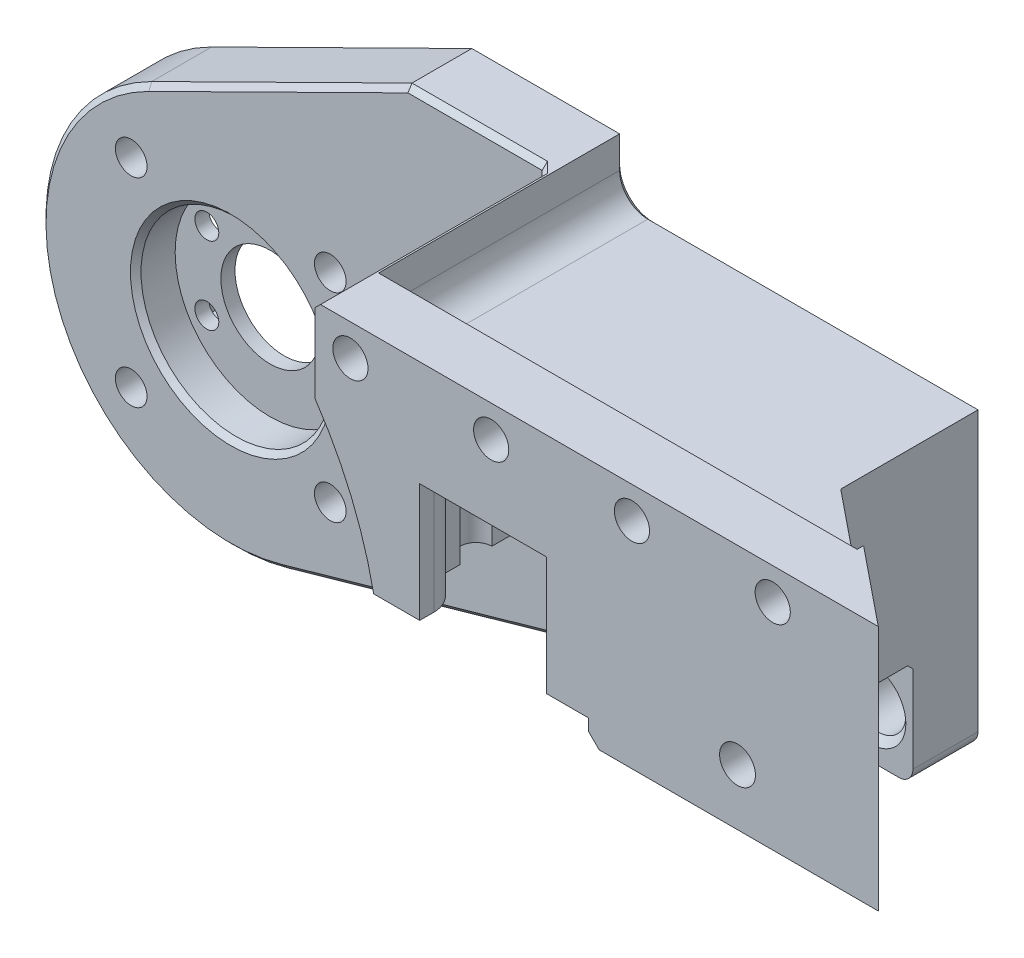
from build123d import *

# Parameters (mm, degrees)
SKETCH1_W           = 270
SKETCH1_H           = 35
BOSS_EXTRUDE1_DEPTH = 10
SKETCH2_W           = 270
SKETCH2_H           = 26
BOSS_EXTRUDE2_DEPTH = 1
CUT_EXTRUDE1_REACH  = 141.821
SKETCH3_R           = 2.55
CUT_EXTRUDE3_REACH  = 141.896
SKETCH4_R           = 8
SKETCH5_R           = 10
CUT_EXTRUDE4_DEPTH  = 1.5
CUT_EXTRUDE5_START  = -1.5
SKETCH6_R           = 10
CUT_EXTRUDE5_DEPTH  = 1.5
BOSS_EXTRUDE3_DEPTH = 43
CUT_EXTRUDE7_DEPTH  = 11
CUT_EXTRUDE8_DEPTH  = 33
SKETCH11_R          = 13.5
SKETCH11_R_2        = 2.25
CUT_EXTRUDE9_DEPTH  = 223.744809143
CUT_EXTRUDE10_REACH = 224.549
SKETCH13_W          = 24
SKETCH13_H          = 30
CUT_EXTRUDE11_DEPTH = 2.4
BOSS_EXTRUDE4_START = -2
SKETCH14_R          = 7
BOSS_EXTRUDE4_DEPTH = 2
CUT_EXTRUDE12_REACH = 226.37
SKETCH16_R          = 1.7
SKETCH17_W          = 24
SKETCH17_H          = 5
CUT_EXTRUDE13_DEPTH = 2
CHAMFER1_SIZE       = 1
CUT_EXTRUDE15_REACH = 224.549
SKETCH20_R          = 2.5
SKETCH18_W          = 295.252066252
SKETCH18_H          = 62.982253344
CUT_EXTRUDE14_DEPTH = 11
CUT_EXTRUDE16_REACH = 232.549
CUT_EXTRUDE16_START = -8
SKETCH26_W          = 25
SKETCH26_H          = 41.606355273
BOSS_EXTRUDE6_DEPTH = 10
SKETCH27_R          = 4
CUT_EXTRUDE19_DEPTH = 8
FILLET1_R           = 2
CUT_EXTRUDE20_DEPTH = 20
SKETCH29_W          = 33.834298197
SKETCH29_H          = 26.449884055
CUT_EXTRUDE21_DEPTH = 3.175
SKETCH30_R          = 1.9
CUT_EXTRUDE22_DEPTH = 15
SKETCH31_R          = 2.25
CUT_EXTRUDE23_DEPTH = 16.825
CUT_EXTRUDE24_REACH = 224.549
SKETCH32_R          = 2.55
BOSS_EXTRUDE7_REACH = 224.549
SKETCH34_W          = 12.654945339
SKETCH34_H          = 26.5
CHAMFER2_SIZE       = 2.25
CHAMFER3_SIZE       = 1
CHAMFER4_SIZE       = 0.75
CHAMFER6_SIZE       = 1.5


with BuildPart() as part:
    # Sketch1 → Boss-Extrude1 (new body)
    with BuildSketch(Plane.XY):
        with Locations((0, -17.5)):
            Rectangle(SKETCH1_W, SKETCH1_H)
    extrude(amount=BOSS_EXTRUDE1_DEPTH)

    # Sketch2 → Boss-Extrude2 (add)
    with BuildSketch(Plane.XY.offset(10)):
        with Locations((0, -22)):
            Rectangle(SKETCH2_W, SKETCH2_H)
    extrude(amount=BOSS_EXTRUDE2_DEPTH)

    # Sketch3 → Cut-Extrude1 (cut, up to next)
    with BuildSketch(Plane.XY.offset(10), mode=Mode.PRIVATE) as cut_extrude1_sk1:
        with Locations((-130, -4.5)):
            Circle(SKETCH3_R)
    cut_extrude1_tool1 = extrude(cut_extrude1_sk1.sketch, amount=-CUT_EXTRUDE1_REACH, mode=Mode.PRIVATE) & part.part
    # Sketch3 → Cut-Extrude1 (cut, up to next)
    with BuildSketch(Plane.XY.offset(10), mode=Mode.PRIVATE) as cut_extrude1_sk2:
        with Locations((-110, -4.5)):
            Circle(SKETCH3_R)
    cut_extrude1_tool2 = extrude(cut_extrude1_sk2.sketch, amount=-CUT_EXTRUDE1_REACH, mode=Mode.PRIVATE) & part.part
    # Sketch3 → Cut-Extrude1 (cut, up to next)
    with BuildSketch(Plane.XY.offset(10), mode=Mode.PRIVATE) as cut_extrude1_sk3:
        with Locations((-90, -4.5)):
            Circle(SKETCH3_R)
    cut_extrude1_tool3 = extrude(cut_extrude1_sk3.sketch, amount=-CUT_EXTRUDE1_REACH, mode=Mode.PRIVATE) & part.part
    # Sketch3 → Cut-Extrude1 (cut, up to next)
    with BuildSketch(Plane.XY.offset(10), mode=Mode.PRIVATE) as cut_extrude1_sk4:
        with Locations((-70, -4.5)):
            Circle(SKETCH3_R)
    cut_extrude1_tool4 = extrude(cut_extrude1_sk4.sketch, amount=-CUT_EXTRUDE1_REACH, mode=Mode.PRIVATE) & part.part
    # Sketch3 → Cut-Extrude1 (cut, up to next)
    with BuildSketch(Plane.XY.offset(10), mode=Mode.PRIVATE) as cut_extrude1_sk5:
        with Locations((-50, -4.5)):
            Circle(SKETCH3_R)
    cut_extrude1_tool5 = extrude(cut_extrude1_sk5.sketch, amount=-CUT_EXTRUDE1_REACH, mode=Mode.PRIVATE) & part.part
    # Sketch3 → Cut-Extrude1 (cut, up to next)
    with BuildSketch(Plane.XY.offset(10), mode=Mode.PRIVATE) as cut_extrude1_sk6:
        with Locations((-30, -4.5)):
            Circle(SKETCH3_R)
    cut_extrude1_tool6 = extrude(cut_extrude1_sk6.sketch, amount=-CUT_EXTRUDE1_REACH, mode=Mode.PRIVATE) & part.part
    # Sketch3 → Cut-Extrude1 (cut, up to next)
    with BuildSketch(Plane.XY.offset(10), mode=Mode.PRIVATE) as cut_extrude1_sk7:
        with Locations((-10, -4.5)):
            Circle(SKETCH3_R)
    cut_extrude1_tool7 = extrude(cut_extrude1_sk7.sketch, amount=-CUT_EXTRUDE1_REACH, mode=Mode.PRIVATE) & part.part
    # Sketch3 → Cut-Extrude1 (cut, up to next)
    with BuildSketch(Plane.XY.offset(10), mode=Mode.PRIVATE) as cut_extrude1_sk8:
        with Locations((10, -4.5)):
            Circle(SKETCH3_R)
    cut_extrude1_tool8 = extrude(cut_extrude1_sk8.sketch, amount=-CUT_EXTRUDE1_REACH, mode=Mode.PRIVATE) & part.part
    # Sketch3 → Cut-Extrude1 (cut, up to next)
    with BuildSketch(Plane.XY.offset(10), mode=Mode.PRIVATE) as cut_extrude1_sk9:
        with Locations((30, -4.5)):
            Circle(SKETCH3_R)
    cut_extrude1_tool9 = extrude(cut_extrude1_sk9.sketch, amount=-CUT_EXTRUDE1_REACH, mode=Mode.PRIVATE) & part.part
    # Sketch3 → Cut-Extrude1 (cut, up to next)
    with BuildSketch(Plane.XY.offset(10), mode=Mode.PRIVATE) as cut_extrude1_sk10:
        with Locations((50, -4.5)):
            Circle(SKETCH3_R)
    cut_extrude1_tool10 = extrude(cut_extrude1_sk10.sketch, amount=-CUT_EXTRUDE1_REACH, mode=Mode.PRIVATE) & part.part
    # Sketch3 → Cut-Extrude1 (cut, up to next)
    with BuildSketch(Plane.XY.offset(10), mode=Mode.PRIVATE) as cut_extrude1_sk11:
        with Locations((70, -4.5)):
            Circle(SKETCH3_R)
    cut_extrude1_tool11 = extrude(cut_extrude1_sk11.sketch, amount=-CUT_EXTRUDE1_REACH, mode=Mode.PRIVATE) & part.part
    # Sketch3 → Cut-Extrude1 (cut, up to next)
    with BuildSketch(Plane.XY.offset(10), mode=Mode.PRIVATE) as cut_extrude1_sk12:
        with Locations((90, -4.5)):
            Circle(SKETCH3_R)
    cut_extrude1_tool12 = extrude(cut_extrude1_sk12.sketch, amount=-CUT_EXTRUDE1_REACH, mode=Mode.PRIVATE) & part.part
    add(cut_extrude1_tool1.solids().sort_by_distance((-130, -4.5, 10))[0], mode=Mode.SUBTRACT)
    add(cut_extrude1_tool2.solids().sort_by_distance((-110, -4.5, 10))[0], mode=Mode.SUBTRACT)
    add(cut_extrude1_tool3.solids().sort_by_distance((-90, -4.5, 10))[0], mode=Mode.SUBTRACT)
    add(cut_extrude1_tool4.solids().sort_by_distance((-70, -4.5, 10))[0], mode=Mode.SUBTRACT)
    add(cut_extrude1_tool5.solids().sort_by_distance((-50, -4.5, 10))[0], mode=Mode.SUBTRACT)
    add(cut_extrude1_tool6.solids().sort_by_distance((-30, -4.5, 10))[0], mode=Mode.SUBTRACT)
    add(cut_extrude1_tool7.solids().sort_by_distance((-10, -4.5, 10))[0], mode=Mode.SUBTRACT)
    add(cut_extrude1_tool8.solids().sort_by_distance((10, -4.5, 10))[0], mode=Mode.SUBTRACT)
    add(cut_extrude1_tool9.solids().sort_by_distance((30, -4.5, 10))[0], mode=Mode.SUBTRACT)
    add(cut_extrude1_tool10.solids().sort_by_distance((50, -4.5, 10))[0], mode=Mode.SUBTRACT)
    add(cut_extrude1_tool11.solids().sort_by_distance((70, -4.5, 10))[0], mode=Mode.SUBTRACT)
    add(cut_extrude1_tool12.solids().sort_by_distance((90, -4.5, 10))[0], mode=Mode.SUBTRACT)

    # Sketch4 → Cut-Extrude3 (cut, up to next)
    with BuildSketch(Plane.XY.offset(11), mode=Mode.PRIVATE) as cut_extrude3_sk1:
        with Locations((123, -20.5)):
            Circle(SKETCH4_R)
    cut_extrude3_tool1 = extrude(cut_extrude3_sk1.sketch, amount=-CUT_EXTRUDE3_REACH, mode=Mode.PRIVATE) & part.part
    add(cut_extrude3_tool1.solids().sort_by_distance((123, -20.5, 11))[0], mode=Mode.SUBTRACT)

    # Sketch5 → Cut-Extrude4 (cut)
    with BuildSketch(Plane.XY.offset(11)):
        with Locations((123, -20.5)):
            Circle(SKETCH5_R)
    extrude(amount=-CUT_EXTRUDE4_DEPTH, mode=Mode.SUBTRACT)

    # Sketch6 → Cut-Extrude5 (cut)
    with BuildSketch(Plane(origin=(0, 0, 0), x_dir=(-1, 0, 0), z_dir=(0, 0, -1)).offset(CUT_EXTRUDE5_START)):
        with Locations(Location((-123, -20.5, 0), (0, 0, 180))):
            Circle(SKETCH6_R)
    extrude(amount=CUT_EXTRUDE5_DEPTH, mode=Mode.SUBTRACT)

    # Sketch8 → Boss-Extrude3 (add)
    with BuildSketch(Plane(origin=(0, 0, 0), x_dir=(-1, 0, 0), z_dir=(0, 0, -1))):
        with BuildLine():
            Line((135, 0), (155, 0))
            Line((155, 0), (191.976940477, -18.30179972))
            ThreePointArc((191.976940477, -18.30179972), (205.188195696, -52.223929122), (172.609863555, -68.468940743))
            Line((172.609863555, -68.468940743), (55, -35))
            Line((55, -35), (55, 0))
            Line((55, 0), (135, 0))
        make_face()
    extrude(amount=BOSS_EXTRUDE3_DEPTH)

    # Sketch9 → Cut-Extrude7 (cut)
    with BuildSketch(Plane.XY.offset(11)):
        with BuildLine():
            Line((-135, -12), (-135, -35))
            Line((-135, -35), (-126.157637496, -35))
            ThreePointArc((-126.157637496, -35), (-129.258467146, -22.992390109), (-135, -12))
        make_face()
    extrude(amount=-CUT_EXTRUDE7_DEPTH, mode=Mode.SUBTRACT)

    # Sketch10 → Cut-Extrude8 (cut)
    with BuildSketch(Plane.XY):
        with BuildLine():
            Line((-135, 0), (-155, 0))
            Line((-155, 0), (-191.976940477, -18.30179972))
            ThreePointArc((-191.976940477, -18.30179972), (-205.188195696, -52.223929122), (-172.609863555, -68.468940743))
            Line((-172.609863555, -68.468940743), (-55, -35))
            Line((-55, -35), (-126.157637496, -35))
            ThreePointArc((-126.157637496, -35), (-129.258467146, -22.992390109), (-135, -12))
            Line((-135, -12), (-135, 0))
        make_face()
    extrude(amount=-CUT_EXTRUDE8_DEPTH, mode=Mode.SUBTRACT)

    # Sketch11 → Cut-Extrude9 (cut, through all)
    with BuildSketch(Plane.XY.offset(-33)):
        with Locations((-180, -42.5)):
            Circle(SKETCH11_R)
        with Locations((-165.857864376, -56.642135624)):
            Circle(SKETCH11_R_2)
        with Locations((-194.142135624, -56.642135624)):
            Circle(SKETCH11_R_2)
        with Locations((-194.142135624, -28.357864376)):
            Circle(SKETCH11_R_2)
        with Locations((-165.857864376, -28.357864376)):
            Circle(SKETCH11_R_2)
    extrude(amount=-CUT_EXTRUDE9_DEPTH, mode=Mode.SUBTRACT)

    # Sketch12 → Cut-Extrude10 (cut, up to next)
    with BuildSketch(Plane(origin=(0, 0, 0), x_dir=(1, 0, 0), z_dir=(0, 1, 0)), mode=Mode.PRIVATE) as cut_extrude10_sk1:
        Polygon((-108.083735041, 43), (-55, 0), (-55, 43), align=None)
    cut_extrude10_tool1 = extrude(cut_extrude10_sk1.sketch, amount=-CUT_EXTRUDE10_REACH, mode=Mode.PRIVATE) & part.part
    add(cut_extrude10_tool1.solids().sort_by_distance((-72.694578, 0, -28.666667))[0], mode=Mode.SUBTRACT)

    # Sketch13 → Cut-Extrude11 (cut)
    with BuildSketch(Plane(origin=(0, 0, -43), x_dir=(-1, 0, 0), z_dir=(0, 0, -1))):
        with Locations((180, -36)):
            Rectangle(SKETCH13_W, SKETCH13_H)
    extrude(amount=-CUT_EXTRUDE11_DEPTH, mode=Mode.SUBTRACT)

    # Sketch14 → Boss-Extrude4 (add)
    with BuildSketch(Plane(origin=(0, 0, -40.6), x_dir=(-1, 0, 0), z_dir=(0, 0, -1)).offset(BOSS_EXTRUDE4_START)):
        with BuildLine():
            ThreePointArc((192, -36.315341562), (180, -29), (168, -36.315341562))
            ThreePointArc((168, -36.315341562), (166.5, -42.5), (168, -48.684658438))
            ThreePointArc((168, -48.684658438), (168.696516797, -49.881142694), (169.511911518, -51))
            ThreePointArc((169.511911518, -51), (180, -56), (190.488088482, -51))
            ThreePointArc((190.488088482, -51), (191.303483203, -49.881142694), (192, -48.684658438))
            ThreePointArc((192, -48.684658438), (193.5, -42.5), (192, -36.315341562))
        make_face()
        with Locations((180, -42.5)):
            Circle(SKETCH14_R, mode=Mode.SUBTRACT)
    extrude(amount=BOSS_EXTRUDE4_DEPTH)

    # Sketch16 → Cut-Extrude12 (cut, up to next)
    with BuildSketch(Plane(origin=(0, 0, -40.6), x_dir=(-1, 0, 0), z_dir=(0, 0, -1)), mode=Mode.PRIVATE) as cut_extrude12_sk1:
        with Locations((171, -37)):
            Circle(SKETCH16_R)
    cut_extrude12_tool1 = extrude(cut_extrude12_sk1.sketch, amount=-CUT_EXTRUDE12_REACH, mode=Mode.PRIVATE) & part.part
    # Sketch16 → Cut-Extrude12 (cut, up to next)
    with BuildSketch(Plane(origin=(0, 0, -40.6), x_dir=(-1, 0, 0), z_dir=(0, 0, -1)), mode=Mode.PRIVATE) as cut_extrude12_sk2:
        with Locations((189, -37)):
            Circle(SKETCH16_R)
    cut_extrude12_tool2 = extrude(cut_extrude12_sk2.sketch, amount=-CUT_EXTRUDE12_REACH, mode=Mode.PRIVATE) & part.part
    # Sketch16 → Cut-Extrude12 (cut, up to next)
    with BuildSketch(Plane(origin=(0, 0, -40.6), x_dir=(-1, 0, 0), z_dir=(0, 0, -1)), mode=Mode.PRIVATE) as cut_extrude12_sk3:
        with Locations((189, -48)):
            Circle(SKETCH16_R)
    cut_extrude12_tool3 = extrude(cut_extrude12_sk3.sketch, amount=-CUT_EXTRUDE12_REACH, mode=Mode.PRIVATE) & part.part
    # Sketch16 → Cut-Extrude12 (cut, up to next)
    with BuildSketch(Plane(origin=(0, 0, -40.6), x_dir=(-1, 0, 0), z_dir=(0, 0, -1)), mode=Mode.PRIVATE) as cut_extrude12_sk4:
        with Locations((171, -48)):
            Circle(SKETCH16_R)
    cut_extrude12_tool4 = extrude(cut_extrude12_sk4.sketch, amount=-CUT_EXTRUDE12_REACH, mode=Mode.PRIVATE) & part.part
    add(cut_extrude12_tool1.solids().sort_by_distance((-171, -37, -40.6))[0], mode=Mode.SUBTRACT)
    add(cut_extrude12_tool2.solids().sort_by_distance((-189, -37, -40.6))[0], mode=Mode.SUBTRACT)
    add(cut_extrude12_tool3.solids().sort_by_distance((-189, -48, -40.6))[0], mode=Mode.SUBTRACT)
    add(cut_extrude12_tool4.solids().sort_by_distance((-171, -48, -40.6))[0], mode=Mode.SUBTRACT)

    # Sketch17 → Cut-Extrude13 (cut)
    with BuildSketch(Plane(origin=(0, 0, -40.6), x_dir=(-1, 0, 0), z_dir=(0, 0, -1))):
        with Locations((180, -23.5)):
            Rectangle(SKETCH17_W, SKETCH17_H)
    extrude(amount=-CUT_EXTRUDE13_DEPTH, mode=Mode.SUBTRACT)

    # Chamfer1
    chamfer1_edges = [part.edges().sort_by_distance(p)[0] for p in [
        (-168, -23.5, -38.6),
        (-180, -21, -38.6),
        (-192, -23.5, -38.6),
        (-180, -26, -38.6),
    ]]
    chamfer(chamfer1_edges, length=CHAMFER1_SIZE)

    # Sketch20 → Cut-Extrude15 (cut, up to next)
    with BuildSketch(Plane.XY, mode=Mode.PRIVATE) as cut_extrude15_sk1:
        with Locations((-130, -4.5)):
            Circle(SKETCH20_R)
    cut_extrude15_tool1 = extrude(cut_extrude15_sk1.sketch, amount=-CUT_EXTRUDE15_REACH, mode=Mode.PRIVATE) & part.part
    # Sketch20 → Cut-Extrude15 (cut, up to next)
    with BuildSketch(Plane.XY, mode=Mode.PRIVATE) as cut_extrude15_sk2:
        with Locations((-110, -4.5)):
            Circle(SKETCH20_R)
    cut_extrude15_tool2 = extrude(cut_extrude15_sk2.sketch, amount=-CUT_EXTRUDE15_REACH, mode=Mode.PRIVATE) & part.part
    # Sketch20 → Cut-Extrude15 (cut, up to next)
    with BuildSketch(Plane.XY, mode=Mode.PRIVATE) as cut_extrude15_sk3:
        with Locations((-90, -4.5)):
            Circle(SKETCH20_R)
    cut_extrude15_tool3 = extrude(cut_extrude15_sk3.sketch, amount=-CUT_EXTRUDE15_REACH, mode=Mode.PRIVATE) & part.part
    # Sketch20 → Cut-Extrude15 (cut, up to next)
    with BuildSketch(Plane.XY, mode=Mode.PRIVATE) as cut_extrude15_sk4:
        with Locations((-70, -4.5)):
            Circle(SKETCH20_R)
    cut_extrude15_tool4 = extrude(cut_extrude15_sk4.sketch, amount=-CUT_EXTRUDE15_REACH, mode=Mode.PRIVATE) & part.part
    add(cut_extrude15_tool1.solids().sort_by_distance((-130, -4.5, 0))[0], mode=Mode.SUBTRACT)
    add(cut_extrude15_tool2.solids().sort_by_distance((-110, -4.5, 0))[0], mode=Mode.SUBTRACT)
    add(cut_extrude15_tool3.solids().sort_by_distance((-90, -4.5, 0))[0], mode=Mode.SUBTRACT)
    add(cut_extrude15_tool4.solids().sort_by_distance((-70, -4.5, 0))[0], mode=Mode.SUBTRACT)

    # Sketch18 → Cut-Extrude14 (cut)
    with BuildSketch(Plane.XY.offset(11)):
        with Locations((-1.232339917, -22.73604416)):
            Rectangle(SKETCH18_W, SKETCH18_H)
    extrude(amount=-CUT_EXTRUDE14_DEPTH, mode=Mode.SUBTRACT)

    # Sketch21 → Cut-Extrude16 (cut, up to next)
    with BuildSketch(Plane.XY.offset(CUT_EXTRUDE16_START), mode=Mode.PRIVATE) as cut_extrude16_sk1:
        with BuildLine():
            Line((-130, -8.5), (-70, -8.5))
            ThreePointArc((-70, -8.5), (-67.171572875, -7.328427125), (-66, -4.5))
            Line((-66, -4.5), (-66, 0))
            Line((-66, 0), (-134, 0))
            Line((-134, 0), (-134, -4.5))
            ThreePointArc((-134, -4.5), (-132.828427125, -7.328427125), (-130, -8.5))
        make_face()
    cut_extrude16_tool1 = extrude(cut_extrude16_sk1.sketch, amount=-CUT_EXTRUDE16_REACH, mode=Mode.PRIVATE) & part.part
    add(cut_extrude16_tool1.solids().sort_by_distance((-100, -4.209641, -8))[0], mode=Mode.SUBTRACT)

    # Sketch26 → Boss-Extrude6 (add)
    with BuildSketch(Plane(origin=(0, 0, -43), x_dir=(-1, 0, 0), z_dir=(0, 0, -1))):
        with Locations((95.583735041, -29.303177637)):
            Rectangle(SKETCH26_W, SKETCH26_H)
    extrude(amount=-BOSS_EXTRUDE6_DEPTH)

    # Sketch27 → Cut-Extrude19 (cut)
    with BuildSketch(Plane.XY.offset(-33)):
        with Locations((-89.083735041, -43)):
            Circle(SKETCH27_R)
    extrude(amount=-CUT_EXTRUDE19_DEPTH, mode=Mode.SUBTRACT)

    # Fillet1
    fillet1_edges = [part.edges().sort_by_distance(p)[0] for p in [
        (-83.083735041, -50.106355273, -38),
    ]]
    fillet(fillet1_edges, radius=FILLET1_R)

    # Sketch28 → Cut-Extrude20 (cut)
    with BuildSketch(Plane.XZ.offset(35)):
        with BuildLine():
            Line((-124.157637496, -6), (-124.157637496, -18))
            ThreePointArc((-124.157637496, -18), (-121.329210371, -19.171572875), (-120.157637496, -22))
            Line((-120.157637496, -22), (-102.157637496, -22))
            ThreePointArc((-102.157637496, -22), (-100.986064621, -19.171572875), (-98.157637496, -18))
            Line((-98.157637496, -18), (-98.157637496, -6))
            ThreePointArc((-98.157637496, -6), (-100.986064621, -4.828427125), (-102.157637496, -2))
            Line((-102.157637496, -2), (-102.157637496, 0))
            Line((-102.157637496, 0), (-120.157637496, 0))
            Line((-120.157637496, 0), (-120.157637496, -2))
            ThreePointArc((-120.157637496, -2), (-121.329210371, -4.828427125), (-124.157637496, -6))
        make_face()
    extrude(amount=-CUT_EXTRUDE20_DEPTH, mode=Mode.SUBTRACT)

    # Sketch29 → Cut-Extrude21 (cut)
    with BuildSketch(Plane.XZ.offset(35)):
        with Locations((-113.074786595, -10.775057973)):
            Rectangle(SKETCH29_W, SKETCH29_H)
    extrude(amount=-CUT_EXTRUDE21_DEPTH, mode=Mode.SUBTRACT)

    # Sketch30 → Cut-Extrude22 (cut)
    with BuildSketch(Plane.XZ.offset(31.825)):
        with Locations(Location((-123.657637496, -2.5, 0), (0, 0, 270))):
            Circle(SKETCH30_R)
        with Locations(Location((-123.657637496, -21.5, 0), (0, 0, 270))):
            Circle(SKETCH30_R)
        with Locations(Location((-98.657637496, -21.5, 0), (0, 0, 270))):
            Circle(SKETCH30_R)
        with Locations(Location((-98.657637496, -2.5, 0), (0, 0, 270))):
            Circle(SKETCH30_R)
    extrude(amount=-CUT_EXTRUDE22_DEPTH, mode=Mode.SUBTRACT)

    # Sketch31 → Cut-Extrude23 (cut)
    with BuildSketch(Plane.XZ.offset(31.825)):
        with Locations((-124.157637496, -12)):
            Circle(SKETCH31_R)
    extrude(amount=-CUT_EXTRUDE23_DEPTH, mode=Mode.SUBTRACT)

    # Cut-Extrude24: up to this plane
    cut_extrude24_end = Plane(origin=(-108.083735041, -69.501, -43), z_dir=(-0.6294409626790586, 0, 0.7770483089883538))
    # Sketch32 → Cut-Extrude24 (cut, up to the surface)
    with BuildSketch(Plane.XY, mode=Mode.PRIVATE) as cut_extrude24_sk1:
        with Locations((-75, -27)):
            Circle(SKETCH32_R)
    cut_extrude24_tool1 = split(extrude(cut_extrude24_sk1.sketch, amount=-CUT_EXTRUDE24_REACH, mode=Mode.PRIVATE), bisect_by=cut_extrude24_end, keep=Keep.BOTH, mode=Mode.PRIVATE)
    add(cut_extrude24_tool1.solids().sort_by_distance((-75, -27, 0))[0], mode=Mode.SUBTRACT)

    # Boss-Extrude7: up to this face of the body (flat: up to its plane)
    boss_extrude7_end = Plane(part.part.faces().sort_by_distance((-74.148109144, -20.199881651, -15.510752824))[0])
    # Sketch34 → Boss-Extrude7 (add, up to the picked face)
    with BuildSketch(Plane(origin=(0, 0, -43), x_dir=(-1, 0, 0), z_dir=(0, 0, -1)), mode=Mode.PRIVATE) as boss_extrude7_sk1:
        with Locations((89.411207711, -21.75)):
            Rectangle(SKETCH34_W, SKETCH34_H)
    boss_extrude7_tool1 = split(extrude(boss_extrude7_sk1.sketch, amount=-BOSS_EXTRUDE7_REACH, mode=Mode.PRIVATE), bisect_by=boss_extrude7_end, keep=Keep.BOTH, mode=Mode.PRIVATE)
    add(boss_extrude7_tool1.solids().sort_by(Axis((-89.411208, -21.75, -43), (0, 0, 1)))[0])

    # Chamfer2
    chamfer2_edges = [part.edges().sort_by_distance(p)[0] for p in [
        (-196.392135624, -28.357864376, -43),
        (-196.392135624, -56.642135624, -43),
        (-168.107864376, -56.642135624, -43),
        (-165.509514806, -26.13499403, -43),
    ]]
    chamfer(chamfer2_edges, length=CHAMFER2_SIZE)

    # Chamfer3
    chamfer3_edges = [part.edges().sort_by_distance(p)[0] for p in [
        (-93.083735041, -43, -33),
    ]]
    chamfer(chamfer3_edges, length=CHAMFER3_SIZE)

    # Chamfer4
    chamfer4_edges = [part.edges().sort_by_distance(p)[0] for p in [
        (-144.5, 0, -43),
        (-205.188195696, -52.223929122, -43),
        (-173.488470238, -9.15089986, -43),
        (-135, -6, -33),
        (-129.258467146, -22.992390109, -33),
        (-104.620686268, -35, -33),
        (-205.188195696, -52.223929122, -33),
        (-173.488470238, -9.15089986, -33),
        (-145, 0, -33),
        (-193.5, -42.5, -33),
        (-140.346799298, -59.287648008, -43),
        (-135, 0, -16.5),
        (-132.828427125, -7.328427125, -43),
        (-134, -2.25, -43),
        (-106.54186752, -8.5, -43),
        (-140.346799298, -59.287648008, -33),
        (-83.083735041, -28.303177637, -43),
        (-96.583735041, -50.106355273, -43),
        (-83.669521478, -49.520568836, -43),
    ]]
    chamfer(chamfer4_edges, length=CHAMFER4_SIZE)

    # Chamfer6
    chamfer6_edges = [part.edges().sort_by_distance(p)[0] for p in [
        (-111.157637496, -35, -24),
        (-96.157637496, -35, -12),
    ]]
    chamfer(chamfer6_edges, length=CHAMFER6_SIZE)


solid = part.part
